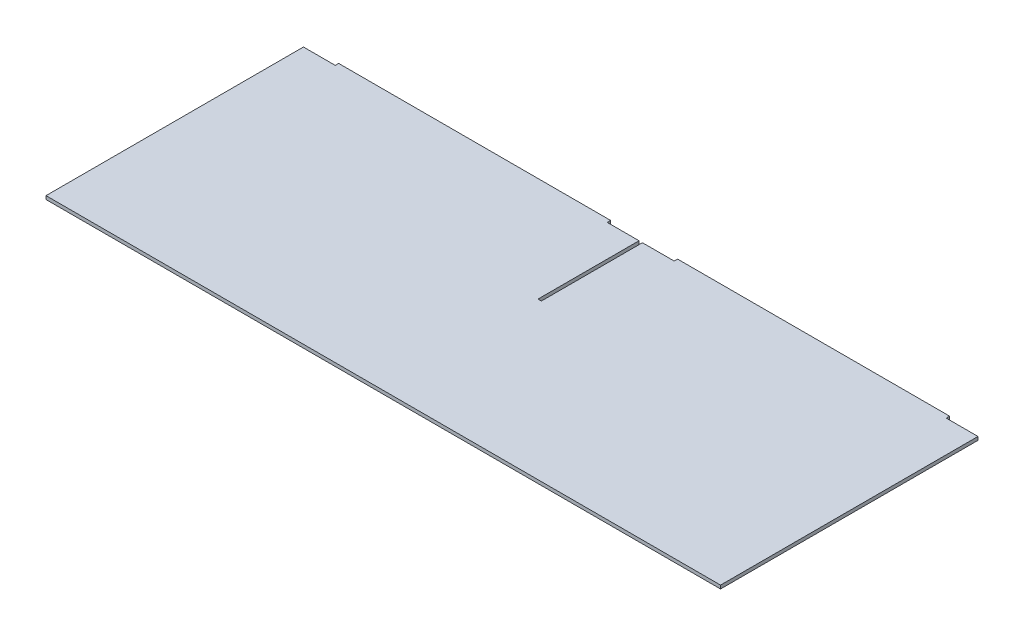
from build123d import *

# Parameters (mm, degrees)
SKETCH1_W           = 629.90984
SKETCH1_H           = 147.69846
BOSS_EXTRUDE1_DEPTH = 3.175
SKETCH3_W           = 254
SKETCH3_H           = 3.175
BOSS_EXTRUDE2_DEPTH = 3.175
SKETCH4_W           = 3.175
SKETCH4_H           = 188.732840052
CUT_EXTRUDE1_DEPTH  = 3.175
SKETCH7_W           = 629.90984
SKETCH7_H           = 92.71
BOSS_EXTRUDE3_DEPTH = 3.175


with BuildPart() as part:
    # Sketch1 → Boss-Extrude1 (new body)
    with BuildSketch(Plane(origin=(0, 0, 0), x_dir=(1, 0, 0), z_dir=(0, 1, 0))):
        with Locations((314.95492, 73.84923)):
            Rectangle(SKETCH1_W, SKETCH1_H)
    extrude(amount=BOSS_EXTRUDE1_DEPTH)

    # Sketch3 → Boss-Extrude2 (add)
    with BuildSketch(Plane(origin=(0, 0, -147.69846), x_dir=(-1, 0, 0), z_dir=(0, 0, -1))):
        with Locations((-473.22613, 1.5875)):
            Rectangle(SKETCH3_W, SKETCH3_H)
        with Locations((-156.68371, 1.5875)):
            Rectangle(SKETCH3_W, SKETCH3_H)
    extrude(amount=BOSS_EXTRUDE2_DEPTH)

    # Sketch4 → Cut-Extrude1 (cut)
    with BuildSketch(Plane(origin=(0, 3.175, 0), x_dir=(1, 0, 0), z_dir=(0, 1, 0))):
        with Locations((314.95492, 147.69846)):
            Rectangle(SKETCH4_W, SKETCH4_H)
    extrude(amount=-CUT_EXTRUDE1_DEPTH, mode=Mode.SUBTRACT)

    # Sketch7 → Boss-Extrude3 (add, through all)
    with BuildSketch(Plane(origin=(0, 3.175, 0), x_dir=(1, 0, 0), z_dir=(0, 1, 0))):
        with Locations((314.95492, -46.355)):
            Rectangle(SKETCH7_W, SKETCH7_H)
    extrude(amount=-BOSS_EXTRUDE3_DEPTH)


solid = part.part
